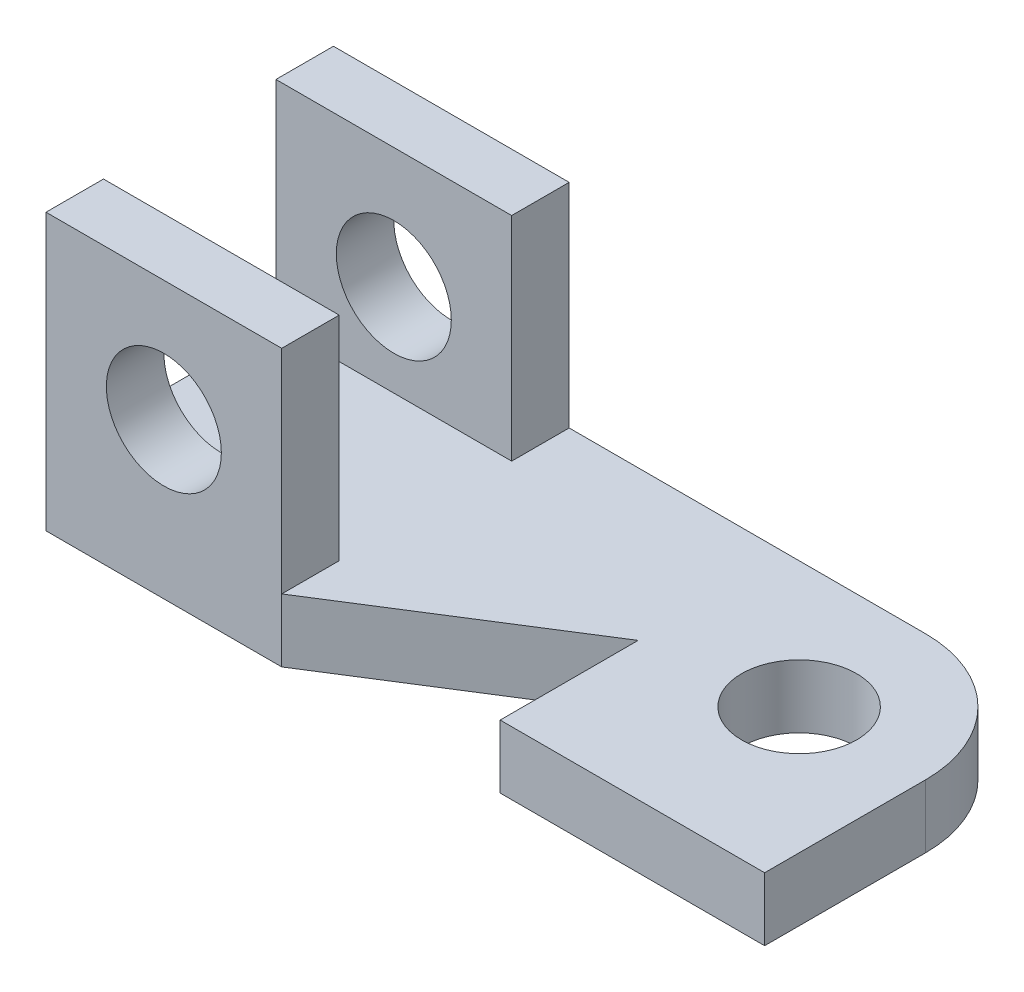
from build123d import *

# Parameters (mm, degrees)
BOSS_EXTRUDE1_DEPTH = 11
SKETCH2_R           = 10
CUT_EXTRUDE1_DEPTH  = 136.077755386
SKETCH4_W           = 41
SKETCH4_H           = 10
BOSS_EXTRUDE2_DEPTH = 48
SKETCH5_R           = 10
CUT_EXTRUDE2_DEPTH  = 143.930052823


with BuildPart() as part:
    # Sketch1 → Boss-Extrude1 (new body)
    with BuildSketch(Plane(origin=(0, 0, 0), x_dir=(1, 0, 0), z_dir=(0, 1, 0))):
        with BuildLine():
            Line((0, 0), (0, 50))
            Line((0, 50), (103, 50))
            ThreePointArc((103, 50), (118.556349186, 43.556349186), (125, 28))
            Line((125, 28), (125, 0))
            Line((125, 0), (79, 0))
            Line((79, 0), (79, 24))
            Line((79, 24), (41, 0))
            Line((41, 0), (0, 0))
        make_face()
    extrude(amount=BOSS_EXTRUDE1_DEPTH)

    # Sketch2 → Cut-Extrude1 (cut, through all)
    with BuildSketch(Plane(origin=(0, 11, 0), x_dir=(1, 0, 0), z_dir=(0, 1, 0))):
        with Locations(Location((103, 28, 0), (0, 0, 270))):
            Circle(SKETCH2_R)
    extrude(amount=-CUT_EXTRUDE1_DEPTH, mode=Mode.SUBTRACT)

    # Sketch4 → Boss-Extrude2 (add)
    with BuildSketch(Plane(origin=(0, 0, 0), x_dir=(1, 0, 0), z_dir=(0, 1, 0))):
        with Locations((20.5, 5)):
            Rectangle(SKETCH4_W, SKETCH4_H)
        with Locations((20.5, 45)):
            Rectangle(SKETCH4_W, SKETCH4_H)
    extrude(amount=BOSS_EXTRUDE2_DEPTH)

    # Sketch5 → Cut-Extrude2 (cut, through all)
    with BuildSketch(Plane.XY):
        with Locations((20.5, 27)):
            Circle(SKETCH5_R)
    extrude(amount=-CUT_EXTRUDE2_DEPTH, mode=Mode.SUBTRACT)


solid = part.part
